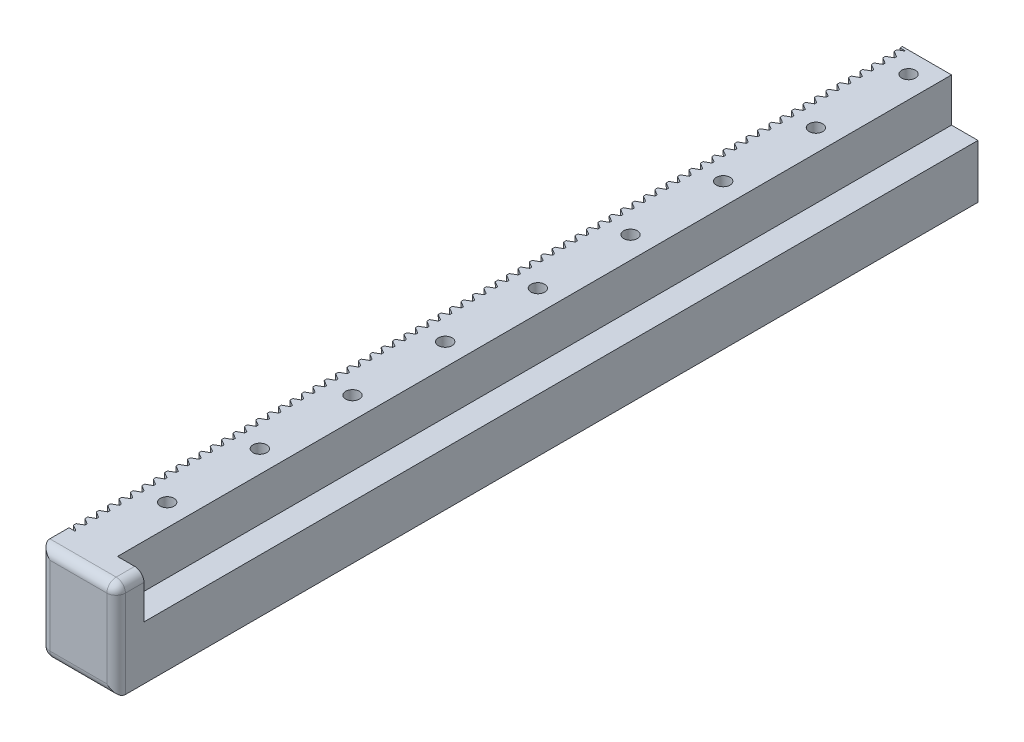
from build123d import *

# Parameters (mm, degrees)
BOSS_EXTRUDE1_DEPTH = 90
SKETCH2_W           = 8.155
SKETCH2_H           = 10.481876136
BOSS_EXTRUDE2_DEPTH = 3
FILLET1_R           = 1
CUT_EXTRUDE2_DEPTH  = 13
LPATTERN1_COUNT     = 24
LPATTERN1_PITCH     = 3.69
SKETCH4_R           = 0.738163421
CUT_EXTRUDE3_DEPTH  = 18


with BuildPart() as part:
    # Sketch1 → Boss-Extrude1 (new body)
    with BuildSketch(Plane.XY):
        Polygon((8.155, 3.559455538), (8.155, -2.228876136), (6.255, -2.228876136), (6.255, 0), (0.288201111, 0), (0, 8.253), (5.3, 8.253), (5.3, 3.559455538), align=None)
    extrude(amount=BOSS_EXTRUDE1_DEPTH)

    # Sketch2 → Boss-Extrude2 (add)
    with BuildSketch(Plane.XY.offset(90)):
        with Locations((4.0775, 3.012061932)):
            Rectangle(SKETCH2_W, SKETCH2_H)
    extrude(amount=BOSS_EXTRUDE2_DEPTH)

    # Fillet1
    fillet1_edges = [part.edges().sort_by_distance(p)[0] for p in [
        (4.0775, 8.253, 93),
        (8.155, 3.012061932, 93),
        (4.0775, -2.228876136, 93),
        (0, 3.012061932, 93),
        (0, -2.228876136, 91.5),
        (8.155, 8.253, 91.5),
    ]]
    fillet(fillet1_edges, radius=FILLET1_R)

    # Sketch3 → Cut-Extrude2 (cut)
    with BuildSketch(Plane(origin=(5.3, 0, 0), x_dir=(0, 0, -1), z_dir=(0, 1, 0))):
        Polygon((-87.581204138, 4.677434927), (-88.071492687, 5.550739132), (-88.589803642, 4.677434927), (-88.811204138, 4.677434927), (-89.301492687, 5.550739132), (-89.819803642, 4.677434927), (-89.932372195, 4.677434927), (-89.932372195, 6.922091214), (-85.121204138, 6.922091214), (-85.121204138, 4.677434927), (-85.611492687, 5.550739132), (-86.129803642, 4.677434927), (-86.351204138, 4.677434927), (-86.841492687, 5.550739132), (-87.359803642, 4.677434927), align=None)
    cut_extrude2 = extrude(amount=CUT_EXTRUDE2_DEPTH, mode=Mode.SUBTRACT)

    # LPattern1: Cut-Extrude2 ×24
    with Locations(*[(0, 0, -i * LPATTERN1_PITCH) for i in range(1, LPATTERN1_COUNT)]):
        add(cut_extrude2, mode=Mode.SUBTRACT)

    # Sketch4 → Cut-Extrude3 (cut)
    with BuildSketch(Plane(origin=(0, 8.253, 0), x_dir=(1, 0, 0), z_dir=(0, 1, 0))):
        with Locations(Location((2.914813358, -2.25139735, 0), (0, 0, 270))):
            Circle(SKETCH4_R)
        with Locations(Location((2.914813358, -12.25139735, 0), (0, 0, 270))):
            Circle(SKETCH4_R)
        with Locations(Location((2.914813358, -22.25139735, 0), (0, 0, 270))):
            Circle(SKETCH4_R)
        with Locations(Location((2.914813358, -32.25139735, 0), (0, 0, 270))):
            Circle(SKETCH4_R)
        with Locations(Location((2.914813358, -42.25139735, 0), (0, 0, 270))):
            Circle(SKETCH4_R)
        with Locations(Location((2.914813358, -52.25139735, 0), (0, 0, 270))):
            Circle(SKETCH4_R)
        with Locations(Location((2.914813358, -62.25139735, 0), (0, 0, 270))):
            Circle(SKETCH4_R)
        with Locations(Location((2.914813358, -72.25139735, 0), (0, 0, 270))):
            Circle(SKETCH4_R)
        with Locations(Location((2.914813358, -82.25139735, 0), (0, 0, 270))):
            Circle(SKETCH4_R)
    extrude(amount=-CUT_EXTRUDE3_DEPTH, mode=Mode.SUBTRACT)


solid = part.part
